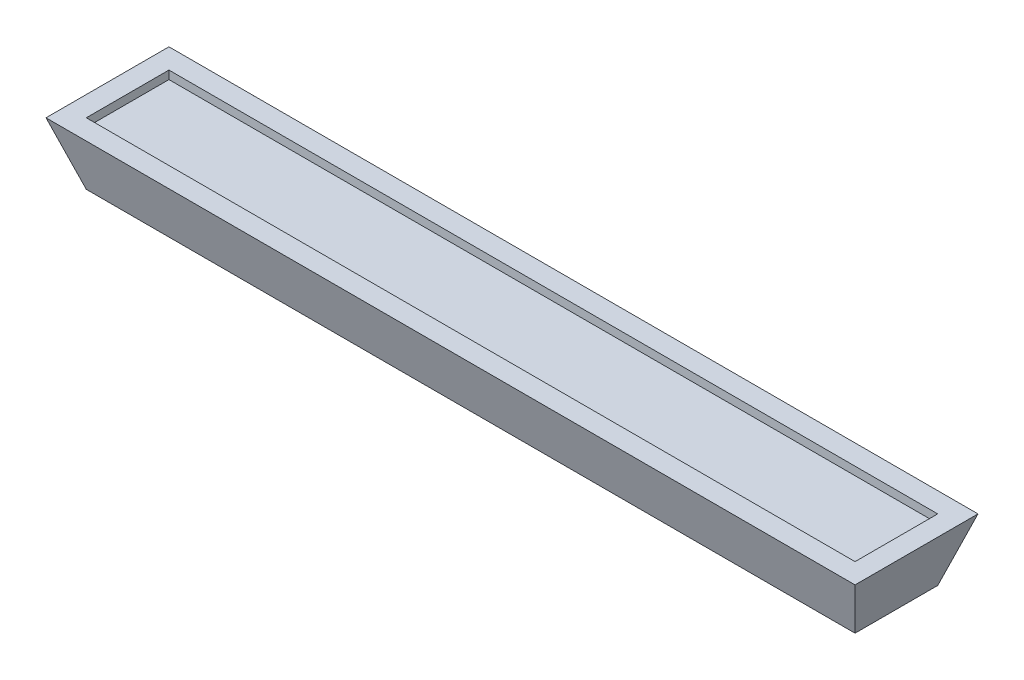
from build123d import *

# Parameters (mm, degrees)
SKETCH_1_W          = 186
SKETCH_1_H          = 20
EXTRUDE_1_DEPTH     = 15
EXTRUDE_1_DRAFT     = -18
SKETCH_2_W          = 186
SKETCH_2_H          = 20
CUT_EXTRUDE_2_DEPTH = 2
SKETCH_3_W          = 177
SKETCH_3_H          = 13
CUT_EXTRUDE_3_DEPTH = 4
SKETCH_4_R          = 2.75
CUT_EXTRUDE_6_DEPTH = 5.5


with BuildPart() as part:
    # 草图1 → 凸台-拉伸1 (with draft: the straight prism first)
    with BuildSketch(Plane(origin=(0, 0, 0), x_dir=(1, 0, 0), z_dir=(0, 1, 0))):
        Rectangle(SKETCH_1_W, SKETCH_1_H)
    extrude(amount=EXTRUDE_1_DEPTH)
    # 凸台-拉伸1: the draft: its side faces are tilted about the plane it starts from
    extrude_1_sides = [part.faces().sort_by_distance(p)[0] for p in [
        (-93, 7.5, 0),
        (0, 7.5, 10),
        (93, 7.5, 0),
        (0, 7.5, -10),
    ]]
    draft(extrude_1_sides, Plane(origin=(0, 0, 0), x_dir=(1, 0, 0), z_dir=(0, 1, 0)), EXTRUDE_1_DRAFT)

    # 草图2 → 切除-拉伸2 (cut)
    with BuildSketch(Plane(origin=(0, 15, 0), x_dir=(1, 0, 0), z_dir=(0, 1, 0))):
        Rectangle(SKETCH_2_W, SKETCH_2_H)
    extrude(amount=-CUT_EXTRUDE_2_DEPTH, mode=Mode.SUBTRACT)

    # 草图3 → 切除-拉伸3 (cut)
    with BuildSketch(Plane.XZ):
        Rectangle(SKETCH_3_W, SKETCH_3_H)
    extrude(amount=-CUT_EXTRUDE_3_DEPTH, mode=Mode.SUBTRACT)

    # 草图4 → 切除-拉伸6 (cut)
    with BuildSketch(Plane.XZ.offset(-4)):
        with Locations(Location((-72, 0, 0), (0, 0, 270))):
            Circle(SKETCH_4_R)
        with Locations(Location((-38, 0, 0), (0, 0, 270))):
            Circle(SKETCH_4_R)
        with Locations(Location((38, 0, 0), (0, 0, 270))):
            Circle(SKETCH_4_R)
        with Locations(Location((72, 0, 0), (0, 0, 270))):
            Circle(SKETCH_4_R)
    extrude(amount=-CUT_EXTRUDE_6_DEPTH, mode=Mode.SUBTRACT)


solid = part.part
